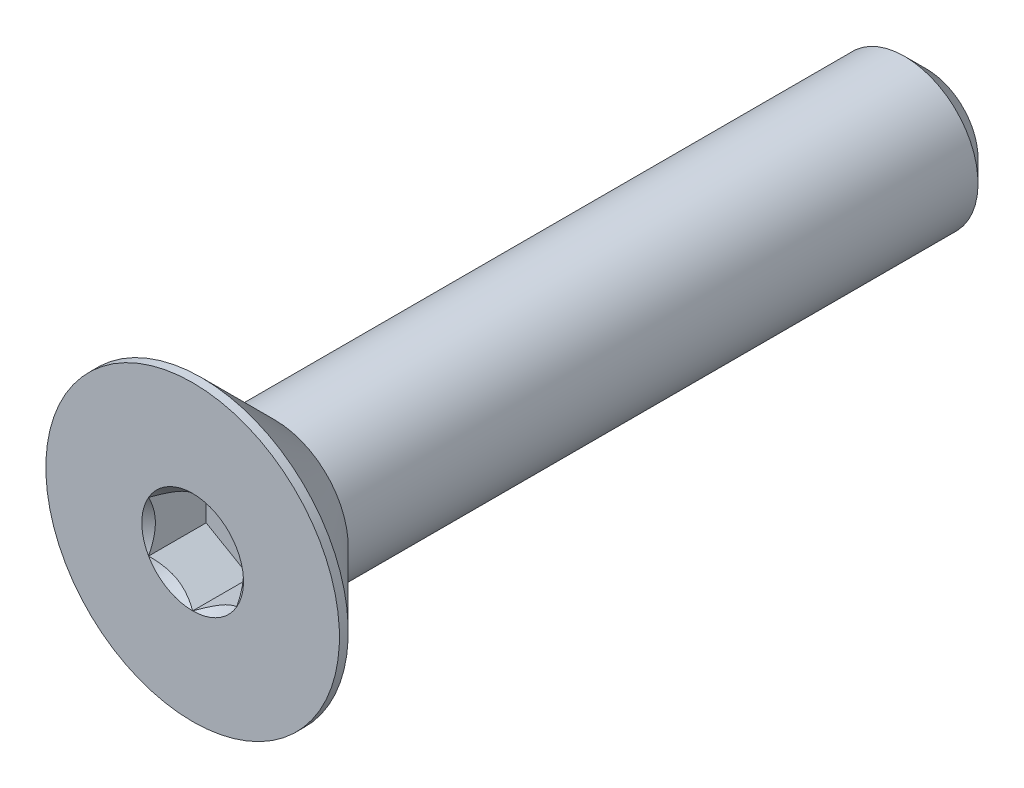
from build123d import *

# Parameters (mm, degrees)
SKETCH3_W          = 25
SKETCH3_H          = 2.5
CHAMFER1_SIZE      = 0.75
CUT_EXTRUDE1_DEPTH = 1.96


with BuildPart() as part:
    # Sketch3 → Revolve1 (revolve)
    with BuildSketch(Plane(origin=(0, 0, 0), x_dir=(0, 0, -1), z_dir=(1, 0, 0))):
        with Locations((0, 1.25)):
            Rectangle(SKETCH3_W, SKETCH3_H)
    revolve(axis=Axis((0, 0, -12.5), (0, 0, 1)))

    # Chamfer1
    chamfer1_edges = [part.edges().sort_by_distance(p)[0] for p in [
        (0, -2.5, -12.5),
    ]]
    chamfer(chamfer1_edges, length=CHAMFER1_SIZE)

    # Sketch6 → Revolve2 (revolve)
    with BuildSketch(Plane(origin=(0, 0, 0), x_dir=(0, 0, -1), z_dir=(1, 0, 0))):
        Polygon((-12.5, 5), (-12.2, 5), (-9.7, 2.5), (-9.7, 0), (-12.5, 0), align=None)
    revolve(axis=Axis((0, 0, -12.5), (0, 0, 1)))

    # Sketch8 → Cut-Extrude1 (cut)
    with BuildSketch(Plane.XY.offset(12.5)):
        Polygon((0, 1.732050808), (-1.5, 0.866025404), (-1.5, -0.866025404), (0, -1.732050808), (1.5, -0.866025404), (1.5, 0.866025404), align=None)
    extrude(amount=-CUT_EXTRUDE1_DEPTH, mode=Mode.SUBTRACT)

    # Cut-Extrude2 cone 1 section (through the dimple's axis) → Cut-Extrude2 (revolve, cut)
    with BuildSketch(Plane(origin=(0, 0, 12.5), x_dir=(0, -1, 0), z_dir=(1, 0, 0))):
        Polygon((0, 0), (1.732050808, 0), (0, 1.732050808), align=None)
    revolve(axis=Axis((0, 0, 12.5), (0, 0, -1)), mode=Mode.SUBTRACT)


solid = part.part
